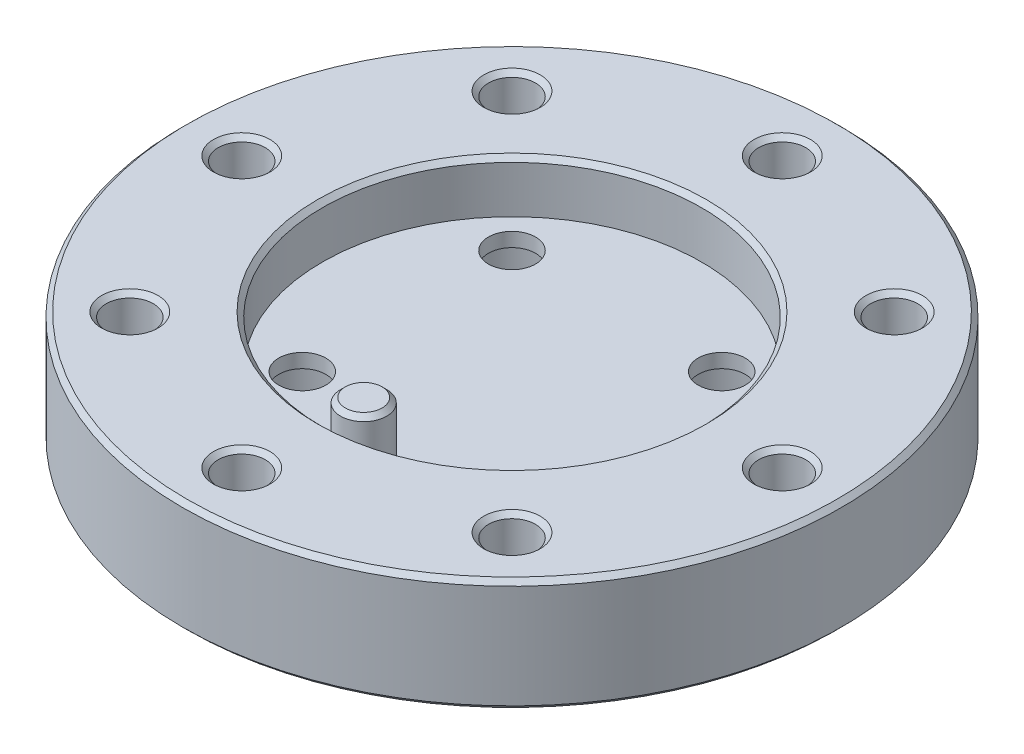
from build123d import *

# Parameters (mm, degrees)
SKETCH1_R           = 35
BOSS_EXTRUDE1_DEPTH = 12
SKETCH2_R           = 20.15
CUT_EXTRUDE1_DEPTH  = 5.5
SKETCH3_R           = 2.45
BOSS_EXTRUDE2_DEPTH = 5.5
SKETCH4_R           = 2.5
CUT_EXTRUDE2_DEPTH  = 50.922439844
SKETCH5_R           = 5.5
CUT_EXTRUDE3_DEPTH  = 5
SKETCH6_R           = 2.5
CUT_EXTRUDE4_DEPTH  = 51.931326313
CHAMFER1_SIZE       = 0.5
CHAMFER2_SIZE       = 0.5
CHAMFER3_SIZE       = 0.5


with BuildPart() as part:
    # Sketch1 → Boss-Extrude1 (new body)
    with BuildSketch(Plane(origin=(0, 0, 0), x_dir=(1, 0, 0), z_dir=(0, 1, 0))):
        with Locations(Location((0, 0, 0), (0, 0, 270))):
            Circle(SKETCH1_R)
    extrude(amount=BOSS_EXTRUDE1_DEPTH)

    # Sketch2 → Cut-Extrude1 (cut)
    with BuildSketch(Plane(origin=(0, 12, 0), x_dir=(1, 0, 0), z_dir=(0, 1, 0))):
        with Locations(Location((0, 0, 0), (0, 0, 270))):
            Circle(SKETCH2_R)
    extrude(amount=-CUT_EXTRUDE1_DEPTH, mode=Mode.SUBTRACT)

    # Sketch3 → Boss-Extrude2 (add)
    with BuildSketch(Plane(origin=(0, 6.5, 0), x_dir=(1, 0, 0), z_dir=(0, 1, 0))):
        with Locations(Location((0, -15.75, 0), (0, 0, 270))):
            Circle(SKETCH3_R)
    extrude(amount=BOSS_EXTRUDE2_DEPTH)

    # Sketch4 → Cut-Extrude2 (cut, through all)
    with BuildSketch(Plane(origin=(0, 6.5, 0), x_dir=(1, 0, 0), z_dir=(0, 1, 0))):
        with Locations(Location((11.136931804, 11.136931804, 0), (0, 0, 270))):
            Circle(SKETCH4_R)
        with Locations(Location((11.136931804, -11.136931804, 0), (0, 0, 270))):
            Circle(SKETCH4_R)
        with Locations(Location((-11.136931804, -11.136931804, 0), (0, 0, 270))):
            Circle(SKETCH4_R)
        with Locations(Location((-11.136931804, 11.136931804, 0), (0, 0, 270))):
            Circle(SKETCH4_R)
    extrude(amount=-CUT_EXTRUDE2_DEPTH, mode=Mode.SUBTRACT)

    # Sketch5 → Cut-Extrude3 (cut)
    with BuildSketch(Plane.XZ):
        with Locations(Location((11.136931804, -11.136931804, 0), (0, 0, 270))):
            Circle(SKETCH5_R)
        with Locations(Location((11.136931804, 11.136931804, 0), (0, 0, 270))):
            Circle(SKETCH5_R)
        with Locations(Location((-11.136931804, -11.136931804, 0), (0, 0, 270))):
            Circle(SKETCH5_R)
        with Locations(Location((-11.136931804, 11.136931804, 0), (0, 0, 270))):
            Circle(SKETCH5_R)
    extrude(amount=-CUT_EXTRUDE3_DEPTH, mode=Mode.SUBTRACT)

    # Sketch6 → Cut-Extrude4 (cut, through all)
    with BuildSketch(Plane.XZ):
        with Locations(Location((28.702, 0, 0), (0, 0, 270))):
            Circle(SKETCH6_R)
        with Locations(Location((20.295378834, -20.295378834, 0), (0, 0, 270))):
            Circle(SKETCH6_R)
        with Locations(Location((0, -28.702, 0), (0, 0, 270))):
            Circle(SKETCH6_R)
        with Locations(Location((-20.295378834, -20.295378834, 0), (0, 0, 270))):
            Circle(SKETCH6_R)
        with Locations(Location((-28.702, 0, 0), (0, 0, 270))):
            Circle(SKETCH6_R)
        with Locations(Location((-20.295378834, 20.295378834, 0), (0, 0, 270))):
            Circle(SKETCH6_R)
        with Locations(Location((0, 28.702, 0), (0, 0, 270))):
            Circle(SKETCH6_R)
        with Locations(Location((20.295378834, 20.295378834, 0), (0, 0, 270))):
            Circle(SKETCH6_R)
    extrude(amount=-CUT_EXTRUDE4_DEPTH, mode=Mode.SUBTRACT)

    # Chamfer1
    chamfer1_edges = [part.edges().sort_by_distance(p)[0] for p in [
        (0, 0, -35),
        (-11.136931804, 0, 16.636931804),
        (-11.136931804, 0, -5.636931804),
        (11.136931804, 0, -5.636931804),
        (11.136931804, 0, 16.636931804),
        (28.702, 0, 2.5),
        (20.295378834, 0, -17.795378834),
        (0, 0, -26.202),
        (-20.295378834, 0, -17.795378834),
        (-28.702, 0, 2.5),
        (-20.295378834, 0, 22.795378834),
        (0, 0, 31.202),
        (20.295378834, 0, 22.795378834),
    ]]
    chamfer(chamfer1_edges, length=CHAMFER1_SIZE)

    # Chamfer2
    chamfer2_edges = [part.edges().sort_by_distance(p)[0] for p in [
        (0, 12, -35),
        (0, 12, -20.15),
        (28.702, 12, 2.5),
        (20.295378834, 12, -17.795378834),
        (0, 12, -26.202),
        (-20.295378834, 12, -17.795378834),
        (-28.702, 12, 2.5),
        (-20.295378834, 12, 22.795378834),
        (0, 12, 31.202),
        (20.295378834, 12, 22.795378834),
    ]]
    chamfer(chamfer2_edges, length=CHAMFER2_SIZE)

    # Chamfer3
    chamfer3_edges = [part.edges().sort_by_distance(p)[0] for p in [
        (0, 12, 13.3),
    ]]
    chamfer(chamfer3_edges, length=CHAMFER3_SIZE)


solid = part.part
